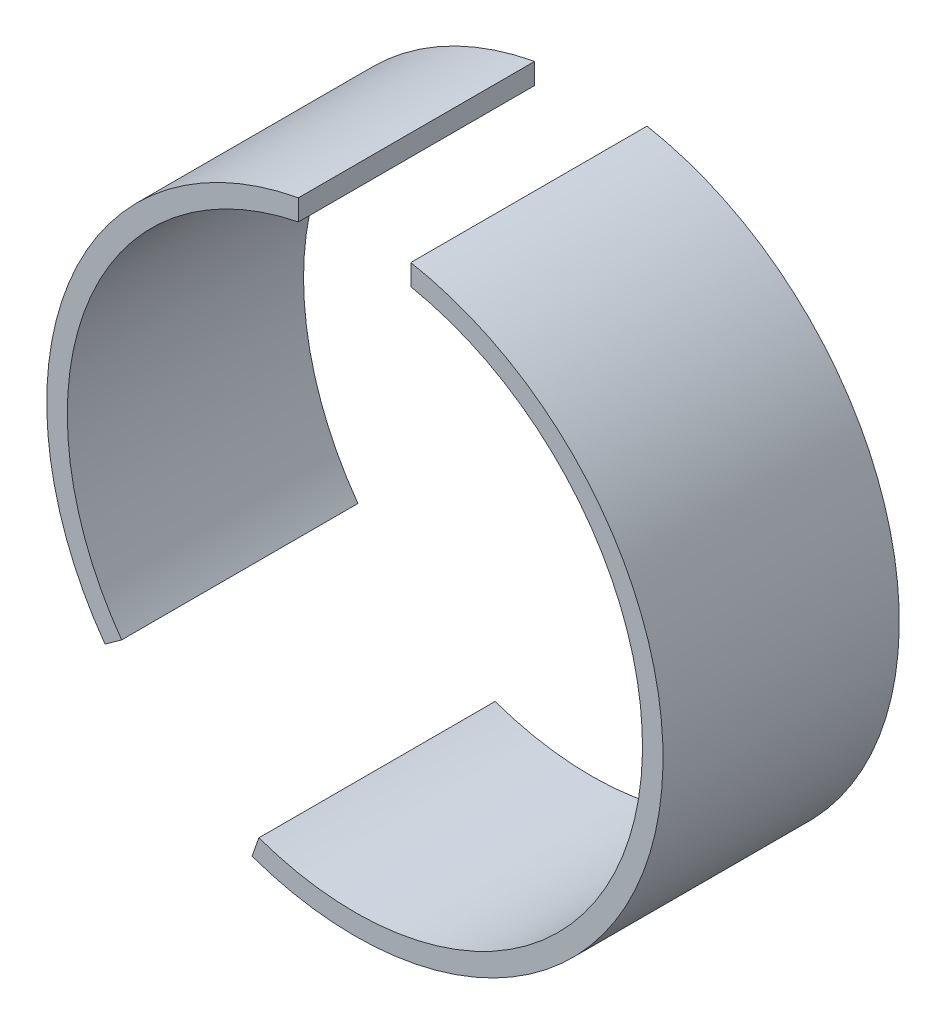
from build123d import *

# Parameters (mm, degrees)
BOSS_EXTRUDE2_DEPTH   = 23
BOSS_EXTRUDE2_2_DEPTH = 23


with BuildPart() as part:
    # Sketch2 → Boss-Extrude2 (new body)
    with BuildSketch(Plane.XY):
        with BuildLine():
            Line((-9.346378644, -26.394037324), (-10.013977119, -28.279325704))
            ThreePointArc((-10.013977119, -28.279325704), (28.981369773, -7.751142245), (5.439963605, 29.502657439))
            Line((5.439963605, 29.502657439), (5.439963605, 27.466466755))
            ThreePointArc((5.439963605, 27.466466755), (27.000990621, -7.412591011), (-9.346378644, -26.394037324))
        make_face()
    extrude(amount=BOSS_EXTRUDE2_DEPTH)


with BuildPart() as body_2:
    # Sketch2 → Boss-Extrude2 2 (new body)
    with BuildSketch(Plane.XY):
        with BuildLine():
            Line((-24.326216711, -17.556627824), (-22.70446893, -16.386185969))
            ThreePointArc((-22.70446893, -16.386185969), (-26.064815845, 10.228654603), (-5.5, 27.454507827))
            Line((-5.5, 27.454507827), (-5.5, 29.491524206))
            ThreePointArc((-5.5, 29.491524206), (-27.852880518, 11.145270155), (-24.326216711, -17.556627824))
        make_face()
    extrude(amount=BOSS_EXTRUDE2_2_DEPTH)


solid = Compound([part.part, body_2.part])
